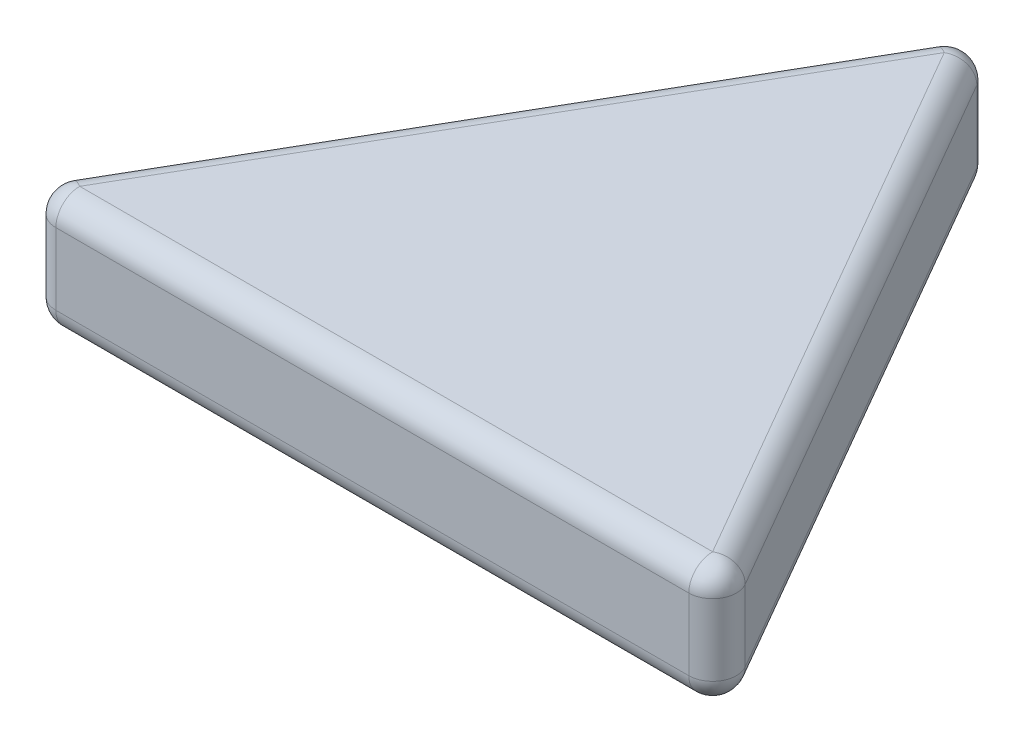
from build123d import *

# Parameters (mm, degrees)
BOSS_EXTRUDE1_DEPTH = 5
FILLET1_R           = 1


with BuildPart() as part:
    # Sketch1 → Boss-Extrude1 (new body)
    with BuildSketch(Plane(origin=(0, 0, 0), x_dir=(1, 0, 0), z_dir=(0, 1, 0))):
        Polygon((0, 0), (15, 25.980762114), (30, 0), align=None)
    extrude(amount=BOSS_EXTRUDE1_DEPTH)

    # Fillet1
    fillet1_edges = [part.edges().sort_by_distance(p)[0] for p in [
        (7.5, 5, -12.990381057),
        (7.5, 0, -12.990381057),
        (22.5, 0, -12.990381057),
        (15, 0, 0),
        (15, 5, 0),
        (0, 2.5, 0),
        (15, 2.5, -25.980762114),
        (30, 2.5, 0),
        (22.5, 5, -12.990381057),
    ]]
    fillet(fillet1_edges, radius=FILLET1_R)


solid = part.part
